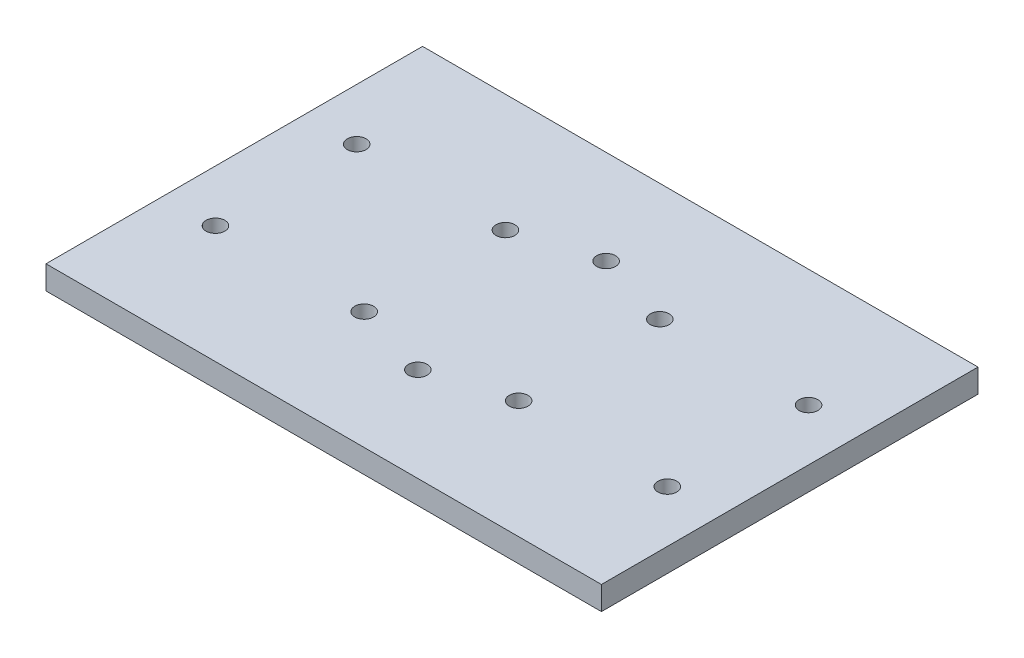
from build123d import *

# Parameters (mm, degrees)
SKETCH1_W           = 118
SKETCH1_H           = 80
BOSS_EXTRUDE1_DEPTH = 5
SKETCH2_R           = 2
CUT_EXTRUDE1_DEPTH  = 5


with BuildPart() as part:
    # Sketch1 → Boss-Extrude1 (new body)
    with BuildSketch(Plane(origin=(0, 0, 0), x_dir=(1, 0, 0), z_dir=(0, 1, 0))):
        with Locations((-241.057142857, 37.964285714)):
            Rectangle(SKETCH1_W, SKETCH1_H)
    extrude(amount=BOSS_EXTRUDE1_DEPTH)

    # Sketch2 → Cut-Extrude1 (cut)
    with BuildSketch(Plane(origin=(0, 5, 0), x_dir=(1, 0, 0), z_dir=(0, 1, 0))):
        with Locations(Location((-289.057142857, 52.964285714, 0), (0, 0, 270))):
            Circle(SKETCH2_R)
        with Locations(Location((-257.457142857, 52.964285714, 0), (0, 0, 270))):
            Circle(SKETCH2_R)
        with Locations(Location((-224.657142857, 52.964285714, 0), (0, 0, 90))):
            Circle(SKETCH2_R)
        with Locations(Location((-193.057142857, 52.964285714, 0), (0, 0, 90))):
            Circle(SKETCH2_R)
        with Locations(Location((-193.057142857, 22.964285714, 0), (0, 0, 270))):
            Circle(SKETCH2_R)
        with Locations(Location((-224.657142857, 22.964285714, 0), (0, 0, 270))):
            Circle(SKETCH2_R)
        with Locations(Location((-257.457142857, 22.964285714, 0), (0, 0, 90))):
            Circle(SKETCH2_R)
        with Locations(Location((-289.057142857, 22.964285714, 0), (0, 0, 90))):
            Circle(SKETCH2_R)
        with Locations(Location((-241.057142857, 57.964285714, 0), (0, 0, 270))):
            Circle(SKETCH2_R)
        with Locations(Location((-241.057142857, 17.964285714, 0), (0, 0, 90))):
            Circle(SKETCH2_R)
    extrude(amount=-CUT_EXTRUDE1_DEPTH, mode=Mode.SUBTRACT)


solid = part.part
